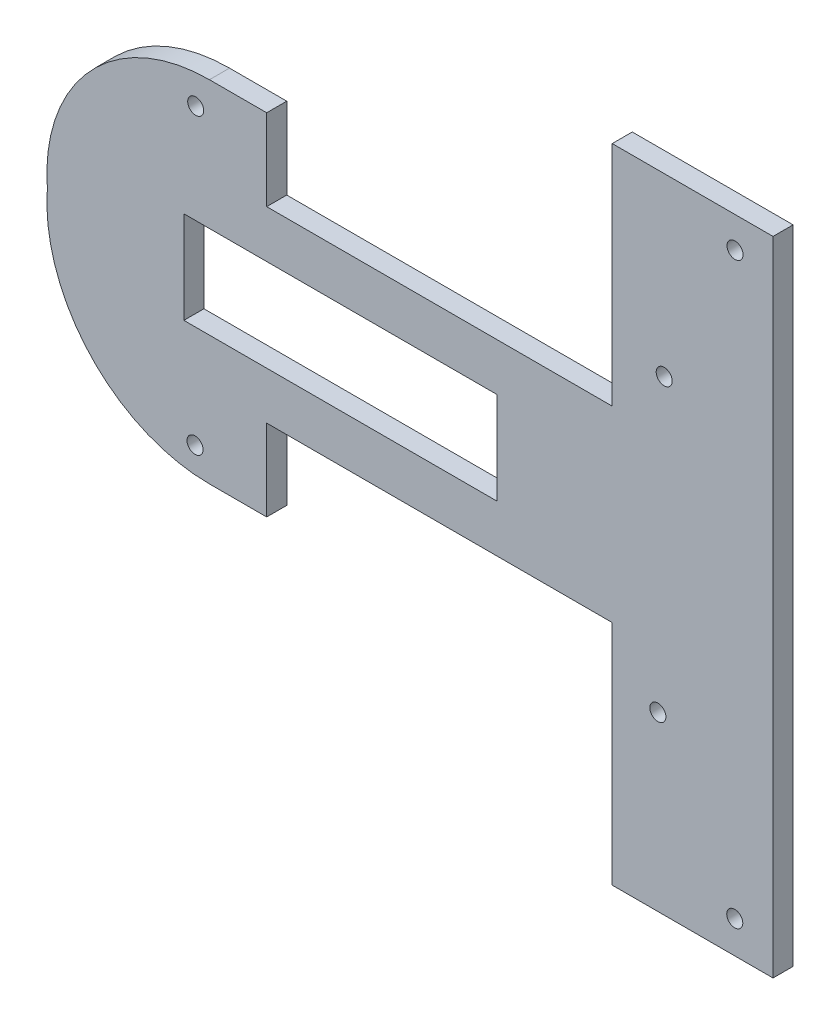
from build123d import *

# Parameters (mm, degrees)
ESQUISSE1_R             = 2
BOSS_EXTRU_2_DEPTH      = 5
ESQUISSE2_W             = 78
ESQUISSE2_H             = 23
ENL_V_MAT_EXTRU_2_DEPTH = 5


with BuildPart() as part:
    # Esquisse1 → Boss.-Extru.2 (new body)
    with BuildSketch(Plane.XY):
        with BuildLine():
            Line((0, 80), (-40.063357395, 80))
            Line((-40.063357395, 80), (-40.063357395, 43.608028339))
            Line((-40.063357395, 43.608028339), (-40.063357395, 23.347203835))
            Line((-40.063357395, 23.347203835), (-126.14466041, 23.347203835))
            Line((-126.14466041, 23.347203835), (-126.14466041, 43.608028339))
            Line((-126.14466041, 43.608028339), (-140.404811956, 43.608028339))
            ThreePointArc((-140.404811956, 43.608028339), (-170.122450923, 30.625328971), (-180.789117416, 0))
            ThreePointArc((-180.789117416, 0), (-170.122450923, -30.625328971), (-140.404811956, -43.608028339))
            Line((-140.404811956, -43.608028339), (-126.14466041, -43.608028339))
            Line((-126.14466041, -43.608028339), (-126.14466041, -23.347203835))
            Line((-126.14466041, -23.347203835), (-40.063357395, -23.347203835))
            Line((-40.063357395, -23.347203835), (-40.063357395, -43.608028339))
            Line((-40.063357395, -43.608028339), (-40.063357395, -80))
            Line((-40.063357395, -80), (0, -80))
            Line((0, -80), (0, 80))
        make_face()
        with Locations((-143.829395777, 36.206579824)):
            Circle(ESQUISSE1_R, mode=Mode.SUBTRACT)
        with Locations((-27.113068306, 36.206579824)):
            Circle(ESQUISSE1_R, mode=Mode.SUBTRACT)
        with Locations((-9.467128793, 72.29182392)):
            Circle(ESQUISSE1_R, mode=Mode.SUBTRACT)
        with Locations(Location((-9.538022857, -71.947546017, 0), (0, 0, 180))):
            Circle(ESQUISSE1_R, mode=Mode.SUBTRACT)
        with Locations(Location((-28.690315975, -37.022776214, 0), (0, 0, 180))):
            Circle(ESQUISSE1_R, mode=Mode.SUBTRACT)
        with Locations(Location((-143.994710805, -37.022776214, 0), (0, 0, 180))):
            Circle(ESQUISSE1_R, mode=Mode.SUBTRACT)
    extrude(amount=BOSS_EXTRU_2_DEPTH)

    # Esquisse2 → Enlèv. mat.-Extru.2 (cut)
    with BuildSketch(Plane.XY.offset(5)):
        with Locations((-107.776795965, 0)):
            Rectangle(ESQUISSE2_W, ESQUISSE2_H)
    extrude(amount=-ENL_V_MAT_EXTRU_2_DEPTH, mode=Mode.SUBTRACT)


solid = part.part
